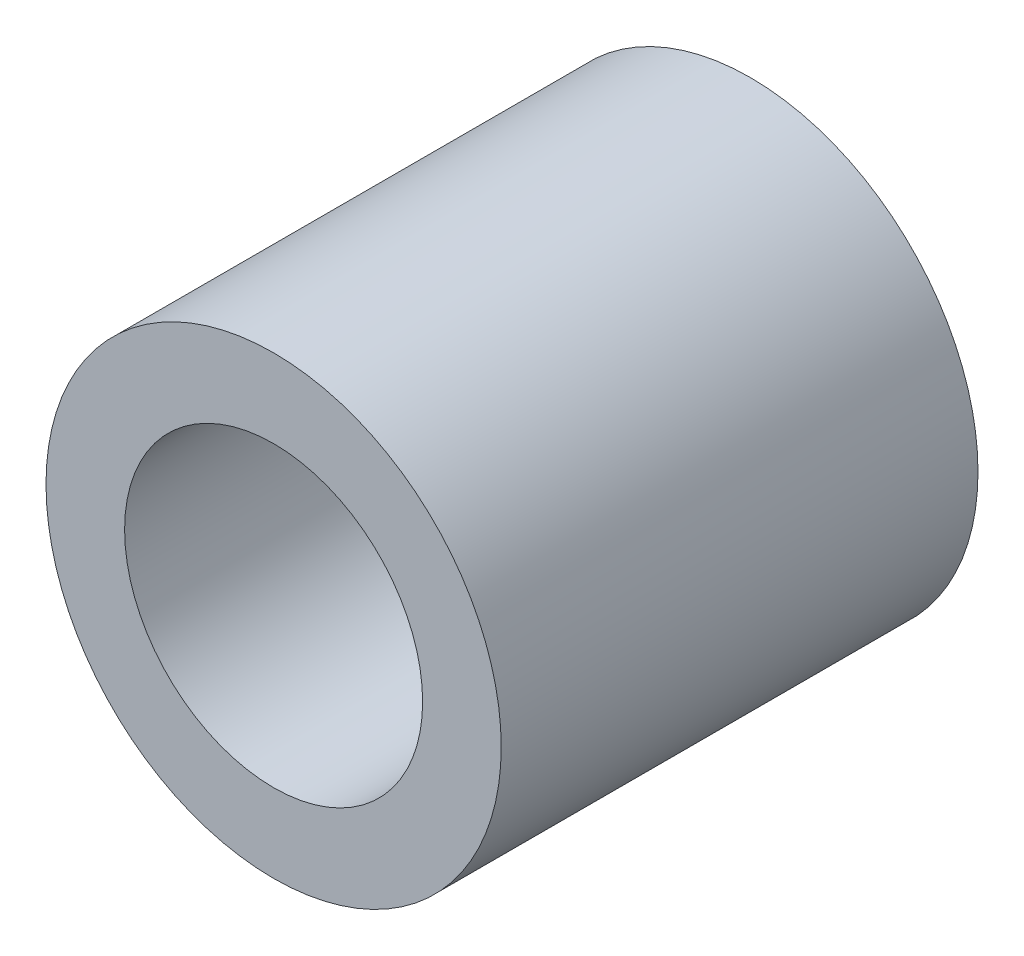
from build123d import *

# Parameters (mm, degrees)
SKETCH1_R           = 7.27456
SKETCH1_R_2         = 4.7625
BOSS_EXTRUDE1_DEPTH = 7.61873


with BuildPart() as part:
    # Sketch1 → Boss-Extrude1 (new, symmetric)
    with BuildSketch(Plane.XY):
        with Locations(Location((0, 0, 0), (0, 0, 180))):
            Circle(SKETCH1_R)
        with Locations(Location((0, 0, 0), (0, 0, 180))):
            Circle(SKETCH1_R_2, mode=Mode.SUBTRACT)
    extrude(amount=BOSS_EXTRUDE1_DEPTH, both=True)


solid = part.part
